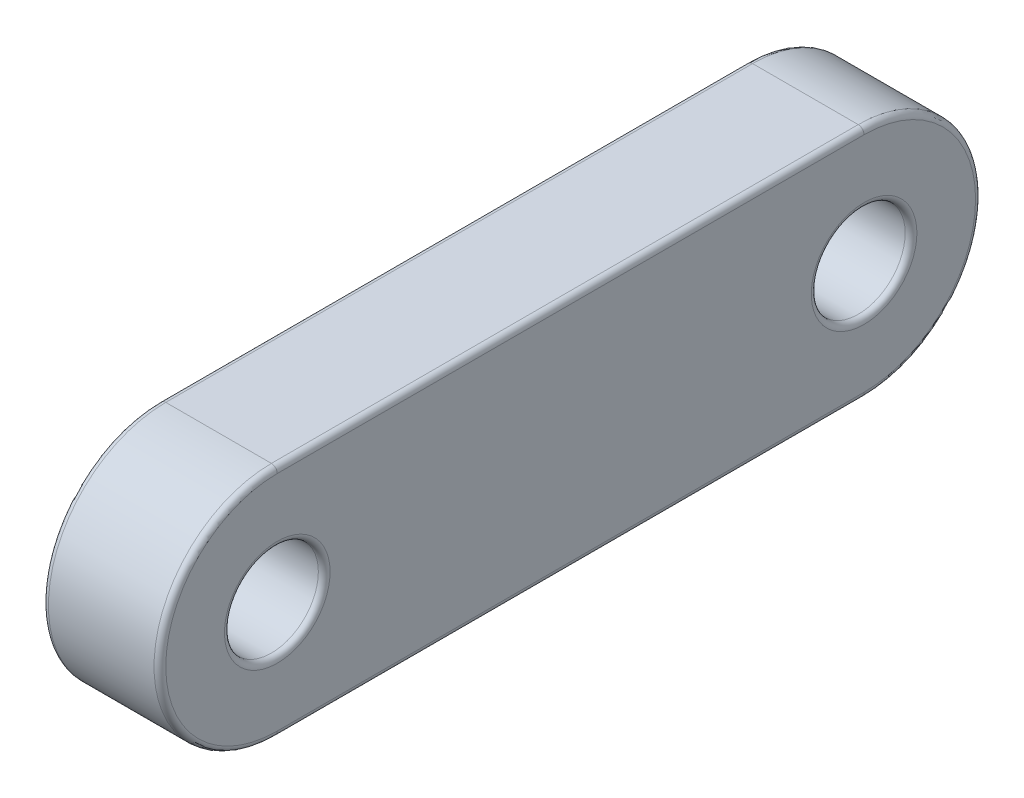
from build123d import *

# Parameters (mm, degrees)
SKETCH_1_R      = 4
EXTRUDE_1_DEPTH = 5
FILLET_1_R      = 0.5


with BuildPart() as part:
    # 草图1 → 凸台-拉伸1 (new, symmetric)
    with BuildSketch(Plane(origin=(0, 0, 0), x_dir=(0, 0, -1), z_dir=(1, 0, 0))):
        with BuildLine():
            Line((0, 10), (50, 10))
            ThreePointArc((50, 10), (60, 0), (50, -10))
            Line((50, -10), (0, -10))
            ThreePointArc((0, -10), (-10, 0), (0, 10))
        make_face()
        Circle(SKETCH_1_R, mode=Mode.SUBTRACT)
        with Locations((50, 0)):
            Circle(SKETCH_1_R, mode=Mode.SUBTRACT)
    extrude(amount=EXTRUDE_1_DEPTH, both=True)

    # 圆角1
    fillet_1_edges = [part.edges().sort_by_distance(p)[0] for p in [
        (-5, 0, 4),
        (5, 0, 4),
        (5, 0, -60),
        (-5, 0, -46),
        (5, 0, -46),
        (5, 10, -25),
        (5, 0, 10),
        (-5, 10, -25),
        (-5, 0, -60),
        (-5, -10, -25),
        (-5, 0, 10),
        (5, -10, -25),
    ]]
    fillet(fillet_1_edges, radius=FILLET_1_R)


solid = part.part
